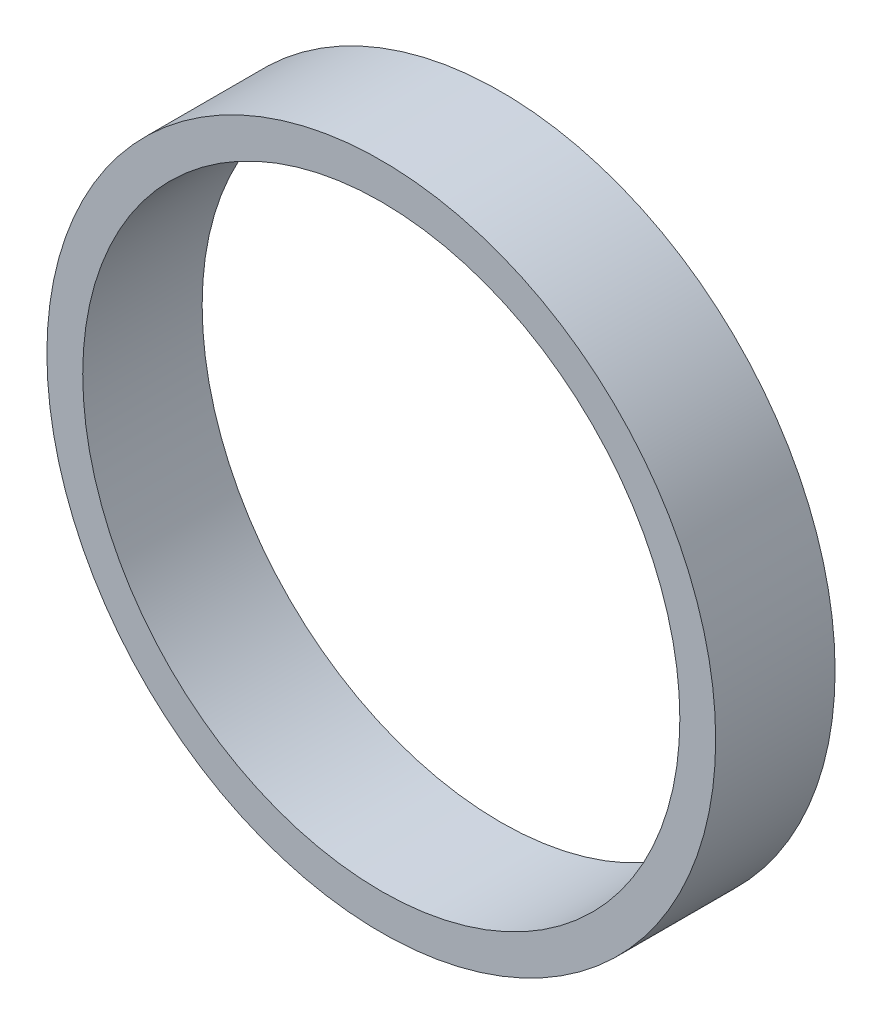
from build123d import *

# Parameters (mm, degrees)
SKETCH1_R           = 28
SKETCH1_R_2         = 25
BOSS_EXTRUDE1_DEPTH = 10


with BuildPart() as part:
    # Sketch1 → Boss-Extrude1 (new body)
    with BuildSketch(Plane.XY):
        Circle(SKETCH1_R)
        Circle(SKETCH1_R_2, mode=Mode.SUBTRACT)
    extrude(amount=BOSS_EXTRUDE1_DEPTH)


solid = part.part
